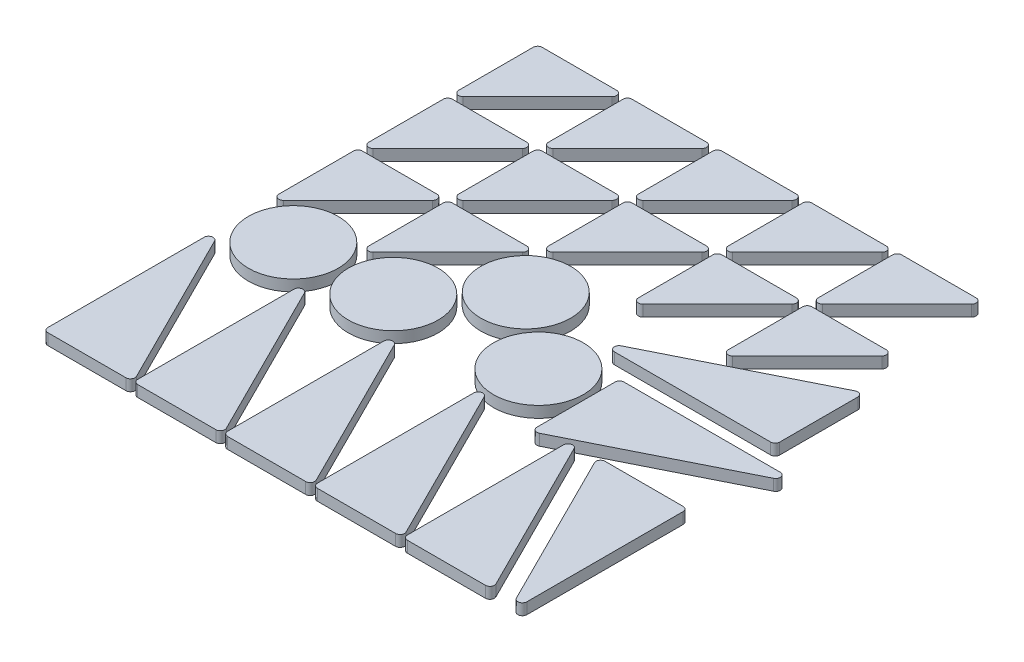
from build123d import *

# Parameters (mm, degrees)
SKETCH1_W           = 304.8
SKETCH1_H           = 304.8
BOSS_EXTRUDE1_DEPTH = 6.35
SKETCH2_OUTSIDE_W   = 393.02
SKETCH2_OUTSIDE_H   = 393.02
SKETCH2_OUTSIDE_R   = 25.4
CUT_EXTRUDE2_DEPTH  = 432.099063441


with BuildPart() as part:
    # Sketch1 → Boss-Extrude1 (new body)
    with BuildSketch(Plane(origin=(0, 0, 0), x_dir=(1, 0, 0), z_dir=(0, 1, 0))):
        with Locations((152.4, 152.4)):
            Rectangle(SKETCH1_W, SKETCH1_H)
    extrude(amount=BOSS_EXTRUDE1_DEPTH)

    # Sketch2 outside → Cut-Extrude2 (cut, through all)
    with BuildSketch(Plane(origin=(0, 6.35, 0), x_dir=(1, 0, 0), z_dir=(0, 1, 0))):
        with Locations((152.4, 152.4)):
            Rectangle(SKETCH2_OUTSIDE_W, SKETCH2_OUTSIDE_H)
        with Locations(Location((40.378551944, 126.297217899, 0), (0, 0, 270))):
            Circle(SKETCH2_OUTSIDE_R, mode=Mode.SUBTRACT)
        with Locations(Location((93.964492013, 129.211934304, 0), (0, 0, 270))):
            Circle(SKETCH2_OUTSIDE_R, mode=Mode.SUBTRACT)
        with Locations(Location((130.510551558, 167.551665483, 0), (0, 0, 270))):
            Circle(SKETCH2_OUTSIDE_R, mode=Mode.SUBTRACT)
        with Locations(Location((171.52597858, 133.696113389, 0), (0, 0, 270))):
            Circle(SKETCH2_OUTSIDE_R, mode=Mode.SUBTRACT)
        with BuildLine():
            Line((12.7, 289.56), (12.7, 247.432102448))
            ThreePointArc((12.7, 247.432102448), (14.267984082, 245.085448436), (17.036051224, 245.636051224))
            Line((17.036051224, 245.636051224), (59.163948776, 287.763948776))
            ThreePointArc((59.163948776, 287.763948776), (59.714551564, 290.532015918), (57.367897552, 292.1))
            Line((57.367897552, 292.1), (15.24, 292.1))
            ThreePointArc((15.24, 292.1), (13.443948776, 291.356051224), (12.7, 289.56))
        make_face(mode=Mode.SUBTRACT)
        with BuildLine():
            Line((67.836051224, 245.636051224), (109.963948776, 287.763948776))
            ThreePointArc((109.963948776, 287.763948776), (110.514551564, 290.532015918), (108.167897552, 292.1))
            Line((108.167897552, 292.1), (66.04, 292.1))
            ThreePointArc((66.04, 292.1), (64.243948776, 291.356051224), (63.5, 289.56))
            Line((63.5, 289.56), (63.5, 247.432102448))
            ThreePointArc((63.5, 247.432102448), (65.067984082, 245.085448436), (67.836051224, 245.636051224))
        make_face(mode=Mode.SUBTRACT)
        with BuildLine():
            Line((118.636051224, 245.636051224), (160.763948776, 287.763948776))
            ThreePointArc((160.763948776, 287.763948776), (161.314551564, 290.532015918), (158.967897552, 292.1))
            Line((158.967897552, 292.1), (116.84, 292.1))
            ThreePointArc((116.84, 292.1), (115.043948776, 291.356051224), (114.3, 289.56))
            Line((114.3, 289.56), (114.3, 247.432102448))
            ThreePointArc((114.3, 247.432102448), (115.867984082, 245.085448436), (118.636051224, 245.636051224))
        make_face(mode=Mode.SUBTRACT)
        with BuildLine():
            Line((169.436051224, 245.636051224), (211.563948776, 287.763948776))
            ThreePointArc((211.563948776, 287.763948776), (212.114551564, 290.532015918), (209.767897552, 292.1))
            Line((209.767897552, 292.1), (167.64, 292.1))
            ThreePointArc((167.64, 292.1), (165.843948776, 291.356051224), (165.1, 289.56))
            Line((165.1, 289.56), (165.1, 247.432102448))
            ThreePointArc((165.1, 247.432102448), (166.667984082, 245.085448436), (169.436051224, 245.636051224))
        make_face(mode=Mode.SUBTRACT)
        with BuildLine():
            Line((220.236051224, 245.636051224), (262.363948776, 287.763948776))
            ThreePointArc((262.363948776, 287.763948776), (262.914551564, 290.532015918), (260.567897552, 292.1))
            Line((260.567897552, 292.1), (218.44, 292.1))
            ThreePointArc((218.44, 292.1), (216.643948776, 291.356051224), (215.9, 289.56))
            Line((215.9, 289.56), (215.9, 247.432102448))
            ThreePointArc((215.9, 247.432102448), (217.467984082, 245.085448436), (220.236051224, 245.636051224))
        make_face(mode=Mode.SUBTRACT)
        with BuildLine():
            Line((67.836051224, 194.836051224), (109.963948776, 236.963948776))
            ThreePointArc((109.963948776, 236.963948776), (110.514551564, 239.732015918), (108.167897552, 241.3))
            Line((108.167897552, 241.3), (66.04, 241.3))
            ThreePointArc((66.04, 241.3), (64.243948776, 240.556051224), (63.5, 238.76))
            Line((63.5, 238.76), (63.5, 196.632102448))
            ThreePointArc((63.5, 196.632102448), (65.067984082, 194.285448436), (67.836051224, 194.836051224))
        make_face(mode=Mode.SUBTRACT)
        with BuildLine():
            Line((118.636051224, 194.836051224), (160.763948776, 236.963948776))
            ThreePointArc((160.763948776, 236.963948776), (161.314551564, 239.732015918), (158.967897552, 241.3))
            Line((158.967897552, 241.3), (116.84, 241.3))
            ThreePointArc((116.84, 241.3), (115.043948776, 240.556051224), (114.3, 238.76))
            Line((114.3, 238.76), (114.3, 196.632102448))
            ThreePointArc((114.3, 196.632102448), (115.867984082, 194.285448436), (118.636051224, 194.836051224))
        make_face(mode=Mode.SUBTRACT)
        with BuildLine():
            Line((169.436051224, 194.836051224), (211.563948776, 236.963948776))
            ThreePointArc((211.563948776, 236.963948776), (212.114551564, 239.732015918), (209.767897552, 241.3))
            Line((209.767897552, 241.3), (167.64, 241.3))
            ThreePointArc((167.64, 241.3), (165.843948776, 240.556051224), (165.1, 238.76))
            Line((165.1, 238.76), (165.1, 196.632102448))
            ThreePointArc((165.1, 196.632102448), (166.667984082, 194.285448436), (169.436051224, 194.836051224))
        make_face(mode=Mode.SUBTRACT)
        with BuildLine():
            Line((220.236051224, 194.836051224), (262.363948776, 236.963948776))
            ThreePointArc((262.363948776, 236.963948776), (262.914551564, 239.732015918), (260.567897552, 241.3))
            Line((260.567897552, 241.3), (218.44, 241.3))
            ThreePointArc((218.44, 241.3), (216.643948776, 240.556051224), (215.9, 238.76))
            Line((215.9, 238.76), (215.9, 196.632102448))
            ThreePointArc((215.9, 196.632102448), (217.467984082, 194.285448436), (220.236051224, 194.836051224))
        make_face(mode=Mode.SUBTRACT)
        with BuildLine():
            Line((17.036051224, 194.836051224), (59.163948776, 236.963948776))
            ThreePointArc((59.163948776, 236.963948776), (59.714551564, 239.732015918), (57.367897552, 241.3))
            Line((57.367897552, 241.3), (15.24, 241.3))
            ThreePointArc((15.24, 241.3), (13.443948776, 240.556051224), (12.7, 238.76))
            Line((12.7, 238.76), (12.7, 196.632102448))
            ThreePointArc((12.7, 196.632102448), (14.267984082, 194.285448436), (17.036051224, 194.836051224))
        make_face(mode=Mode.SUBTRACT)
        with BuildLine():
            Line((17.036051224, 144.036051224), (59.163948776, 186.163948776))
            ThreePointArc((59.163948776, 186.163948776), (59.714551564, 188.932015918), (57.367897552, 190.5))
            Line((57.367897552, 190.5), (15.24, 190.5))
            ThreePointArc((15.24, 190.5), (13.443948776, 189.756051224), (12.7, 187.96))
            Line((12.7, 187.96), (12.7, 145.832102448))
            ThreePointArc((12.7, 145.832102448), (14.267984082, 143.485448436), (17.036051224, 144.036051224))
        make_face(mode=Mode.SUBTRACT)
        with BuildLine():
            Line((67.836051224, 144.036051224), (109.963948776, 186.163948776))
            ThreePointArc((109.963948776, 186.163948776), (110.514551564, 188.932015918), (108.167897552, 190.5))
            Line((108.167897552, 190.5), (66.04, 190.5))
            ThreePointArc((66.04, 190.5), (64.243948776, 189.756051224), (63.5, 187.96))
            Line((63.5, 187.96), (63.5, 145.832102448))
            ThreePointArc((63.5, 145.832102448), (65.067984082, 143.485448436), (67.836051224, 144.036051224))
        make_face(mode=Mode.SUBTRACT)
        with BuildLine():
            Line((12.7, 15.24), (12.7, 103.540387337))
            ThreePointArc((12.7, 103.540387337), (14.656427582, 106.01243977), (17.511845065, 104.67630987))
            Line((17.511845065, 104.67630987), (61.662038734, 16.375922533))
            ThreePointArc((61.662038734, 16.375922533), (61.550846722, 13.904642975), (59.390193669, 12.7))
            Line((59.390193669, 12.7), (15.24, 12.7))
            ThreePointArc((15.24, 12.7), (13.443948776, 13.443948776), (12.7, 15.24))
        make_face(mode=Mode.SUBTRACT)
        with BuildLine():
            Line((68.311845065, 104.67630987), (112.462038734, 16.375922533))
            ThreePointArc((112.462038734, 16.375922533), (112.350846722, 13.904642975), (110.190193669, 12.7))
            Line((110.190193669, 12.7), (66.04, 12.7))
            ThreePointArc((66.04, 12.7), (64.243948776, 13.443948776), (63.5, 15.24))
            Line((63.5, 15.24), (63.5, 103.540387337))
            ThreePointArc((63.5, 103.540387337), (65.456427582, 106.01243977), (68.311845065, 104.67630987))
        make_face(mode=Mode.SUBTRACT)
        with BuildLine():
            Line((119.111845065, 104.67630987), (163.262038734, 16.375922533))
            ThreePointArc((163.262038734, 16.375922533), (163.150846722, 13.904642975), (160.990193669, 12.7))
            Line((160.990193669, 12.7), (116.84, 12.7))
            ThreePointArc((116.84, 12.7), (115.043948776, 13.443948776), (114.3, 15.24))
            Line((114.3, 15.24), (114.3, 103.540387337))
            ThreePointArc((114.3, 103.540387337), (116.256427582, 106.01243977), (119.111845065, 104.67630987))
        make_face(mode=Mode.SUBTRACT)
        with BuildLine():
            Line((169.911845065, 104.67630987), (214.062038734, 16.375922533))
            ThreePointArc((214.062038734, 16.375922533), (213.950846722, 13.904642975), (211.790193669, 12.7))
            Line((211.790193669, 12.7), (167.64, 12.7))
            ThreePointArc((167.64, 12.7), (165.843948776, 13.443948776), (165.1, 15.24))
            Line((165.1, 15.24), (165.1, 103.540387337))
            ThreePointArc((165.1, 103.540387337), (167.056427582, 106.01243977), (169.911845065, 104.67630987))
        make_face(mode=Mode.SUBTRACT)
        with BuildLine():
            Line((220.711845065, 104.67630987), (264.862038734, 16.375922533))
            ThreePointArc((264.862038734, 16.375922533), (264.750846722, 13.904642975), (262.590193669, 12.7))
            Line((262.590193669, 12.7), (218.44, 12.7))
            ThreePointArc((218.44, 12.7), (216.643948776, 13.443948776), (215.9, 15.24))
            Line((215.9, 15.24), (215.9, 103.540387337))
            ThreePointArc((215.9, 103.540387337), (217.856427582, 106.01243977), (220.711845065, 104.67630987))
        make_face(mode=Mode.SUBTRACT)
        with BuildLine():
            Line((277.552172751, 15.24), (233.401979083, 103.540387337))
            ThreePointArc((233.401979083, 103.540387337), (233.513171095, 106.011666895), (235.673824148, 107.21630987))
            Line((235.673824148, 107.21630987), (279.824017817, 107.21630987))
            ThreePointArc((279.824017817, 107.21630987), (281.620069041, 106.472361094), (282.364017817, 104.67630987))
            Line((282.364017817, 104.67630987), (282.364017817, 16.375922533))
            ThreePointArc((282.364017817, 16.375922533), (280.407590235, 13.903870099), (277.552172751, 15.24))
        make_face(mode=Mode.SUBTRACT)
        with BuildLine():
            Line((291.693726792, 146.554658473), (203.393339455, 102.404464805))
            ThreePointArc((203.393339455, 102.404464805), (200.922059898, 102.515656817), (199.717416922, 104.67630987))
            Line((199.717416922, 104.67630987), (199.717416922, 148.826503538))
            ThreePointArc((199.717416922, 148.826503538), (200.461365698, 150.622554763), (202.257416922, 151.366503538))
            Line((202.257416922, 151.366503538), (290.55780426, 151.366503538))
            ThreePointArc((290.55780426, 151.366503538), (293.029856693, 149.410075956), (291.693726792, 146.554658473))
        make_face(mode=Mode.SUBTRACT)
        with BuildLine():
            Line((183.6711366, 168.254047869), (271.971523937, 212.404241537))
            ThreePointArc((271.971523937, 212.404241537), (274.442803495, 212.293049525), (275.64744647, 210.132396472))
            Line((275.64744647, 210.132396472), (275.64744647, 165.982202803))
            ThreePointArc((275.64744647, 165.982202803), (274.903497694, 164.186151579), (273.10744647, 163.442202803))
            Line((273.10744647, 163.442202803), (184.807059133, 163.442202803))
            ThreePointArc((184.807059133, 163.442202803), (182.335006699, 165.398630385), (183.6711366, 168.254047869))
        make_face(mode=Mode.SUBTRACT)
    extrude(amount=-CUT_EXTRUDE2_DEPTH, mode=Mode.SUBTRACT)


solid = part.part
